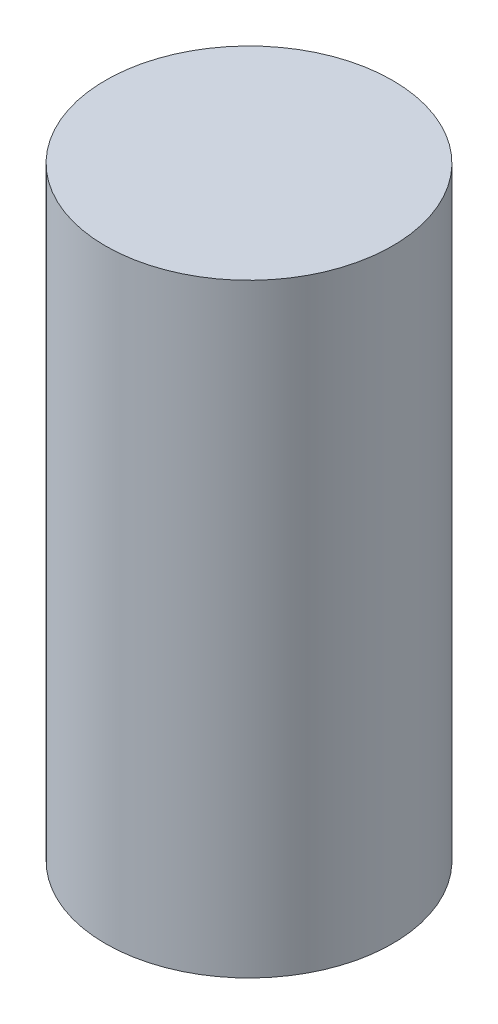
from build123d import *

# Parameters (mm, degrees)
SKETCH1_R           = 95
BOSS_EXTRUDE1_DEPTH = 400


with BuildPart() as part:
    # Sketch1 → Boss-Extrude1 (new body)
    with BuildSketch(Plane(origin=(0, 0, 0), x_dir=(1, 0, 0), z_dir=(0, 1, 0))):
        with Locations(Location((0, 0, 0), (0, 0, 270))):
            Circle(SKETCH1_R)
    extrude(amount=BOSS_EXTRUDE1_DEPTH)


solid = part.part
